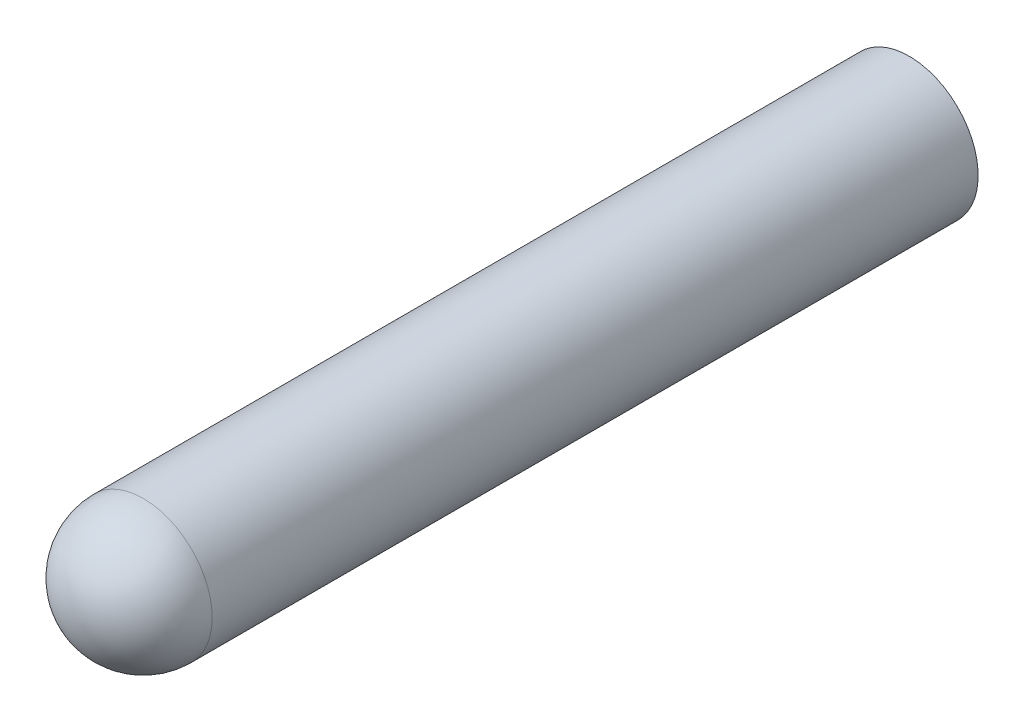
from build123d import *


with BuildPart() as part:
    # Croquis1 → Revolución1 (revolve)
    with BuildSketch(Plane(origin=(0, 0, 0), x_dir=(1, 0, 0), z_dir=(0, 1, 0)), mode=Mode.PRIVATE) as revoluci_n1_sk:
        with BuildLine():
            Line((0, -27.25), (0, -25.75))
            ThreePointArc((0, -25.75), (4.772970773, -23.772970773), (6.75, -19))
            Line((6.75, -19), (6.75, 72.75))
            Line((6.75, 72.75), (8.25, 72.75))
            Line((8.25, 72.75), (8.25, -19))
            ThreePointArc((8.25, -19), (5.833630945, -24.833630945), (0, -27.25))
        make_face()
    revolve(revoluci_n1_sk.sketch.rotate(Axis((0, 0, 30.306656457), (0, 0, -1)), 180), axis=Axis((0, 0, 30.306656457), (0, 0, -1)))


solid = part.part
